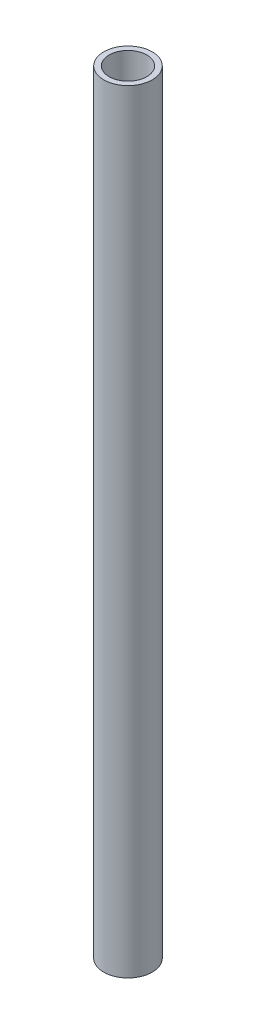
from build123d import *

# Parameters (mm, degrees)
SKETCH1_R           = 1.57
SKETCH1_R_2         = 1.22
BOSS_EXTRUDE1_DEPTH = 50


with BuildPart() as part:
    # Sketch1 → Boss-Extrude1 (new body)
    with BuildSketch(Plane(origin=(0, 0, 0), x_dir=(1, 0, 0), z_dir=(0, 1, 0))):
        with Locations(Location((0, 0, 0), (0, 0, 270))):
            Circle(SKETCH1_R)
        with Locations(Location((0, 0, 0), (0, 0, 270))):
            Circle(SKETCH1_R_2, mode=Mode.SUBTRACT)
    extrude(amount=BOSS_EXTRUDE1_DEPTH)


solid = part.part
